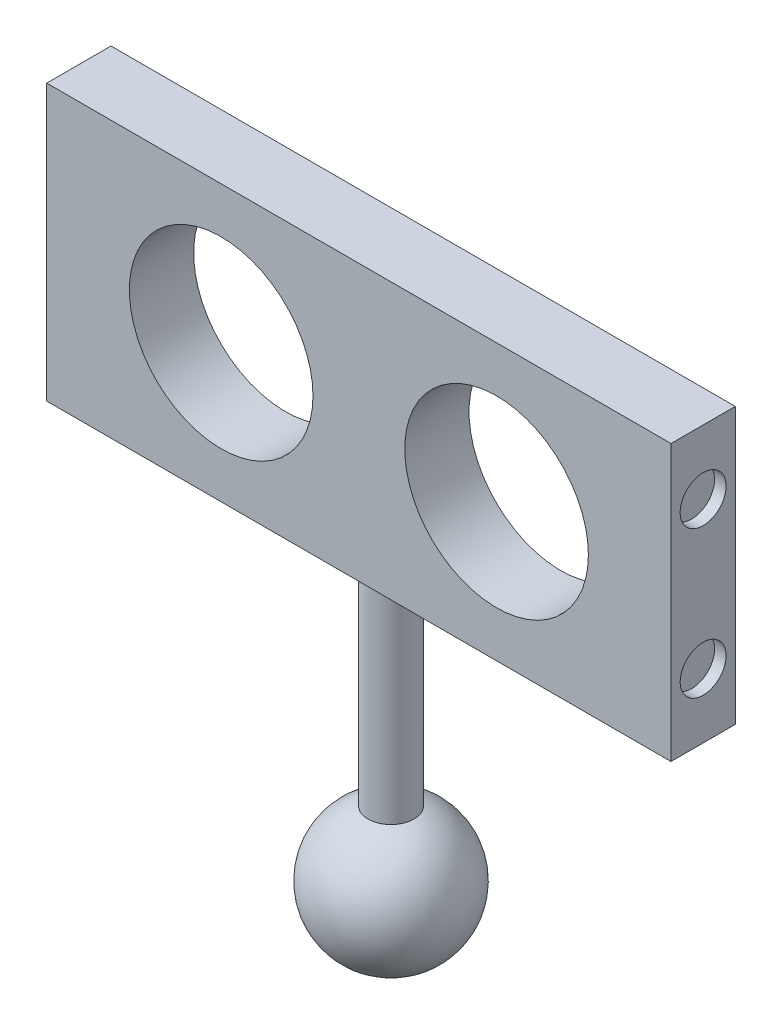
from build123d import *

# Parameters (mm, degrees)
SKETCH1_W           = 86.36
SKETCH1_H           = 8.89
BOSS_EXTRUDE1_DEPTH = 38.1
SKETCH2_R           = 12.7
CUT_EXTRUDE1_DEPTH  = 59.267954315
SKETCH3_R           = 3.175
BOSS_EXTRUDE2_DEPTH = 38.1
SKETCH5_R           = 3.175
CUT_EXTRUDE2_DEPTH  = 1.5875


with BuildPart() as part:
    # Sketch1 → Boss-Extrude1 (new body)
    with BuildSketch(Plane(origin=(0, 0, 0), x_dir=(1, 0, 0), z_dir=(0, 1, 0))):
        Rectangle(SKETCH1_W, SKETCH1_H)
    extrude(amount=BOSS_EXTRUDE1_DEPTH)

    # Sketch2 → Cut-Extrude1 (cut, through all)
    with BuildSketch(Plane.XY.offset(4.445)):
        with Locations((19.05, 19.05)):
            Circle(SKETCH2_R)
        with Locations((-19.05, 19.05)):
            Circle(SKETCH2_R)
    extrude(amount=-CUT_EXTRUDE1_DEPTH, mode=Mode.SUBTRACT)

    # Sketch3 → Boss-Extrude2 (add)
    with BuildSketch(Plane.XZ):
        with Locations(Location((0, 0, 0), (0, 0, 90))):
            Circle(SKETCH3_R)
    extrude(amount=BOSS_EXTRUDE2_DEPTH)

    # Sketch4 → Revolve1 (revolve)
    with BuildSketch(Plane.XZ.offset(38.1)):
        with BuildLine():
            Line((0, -9.525), (0, 9.525))
            ThreePointArc((0, 9.525), (9.525, 0), (0, -9.525))
        make_face()
    revolve(axis=Axis((0, -38.1, -9.525), (0, 0, 1)))

    # Sketch5 → Cut-Extrude2 (cut)
    with BuildSketch(Plane(origin=(43.18, 0, 0), x_dir=(0, 0, -1), z_dir=(1, 0, 0))):
        with Locations((0, 29.21)):
            Circle(SKETCH5_R)
        with Locations(Location((0, 8.89, 0), (0, 0, 180))):
            Circle(SKETCH5_R)
    cut_extrude2 = extrude(amount=-CUT_EXTRUDE2_DEPTH, mode=Mode.SUBTRACT)

    # Mirror1: Cut-Extrude2 across plane
    add(cut_extrude2.mirror(Plane(origin=(0, 0, 0), x_dir=(0, 0, 1), z_dir=(1, 0, 0))), mode=Mode.SUBTRACT)


solid = part.part
